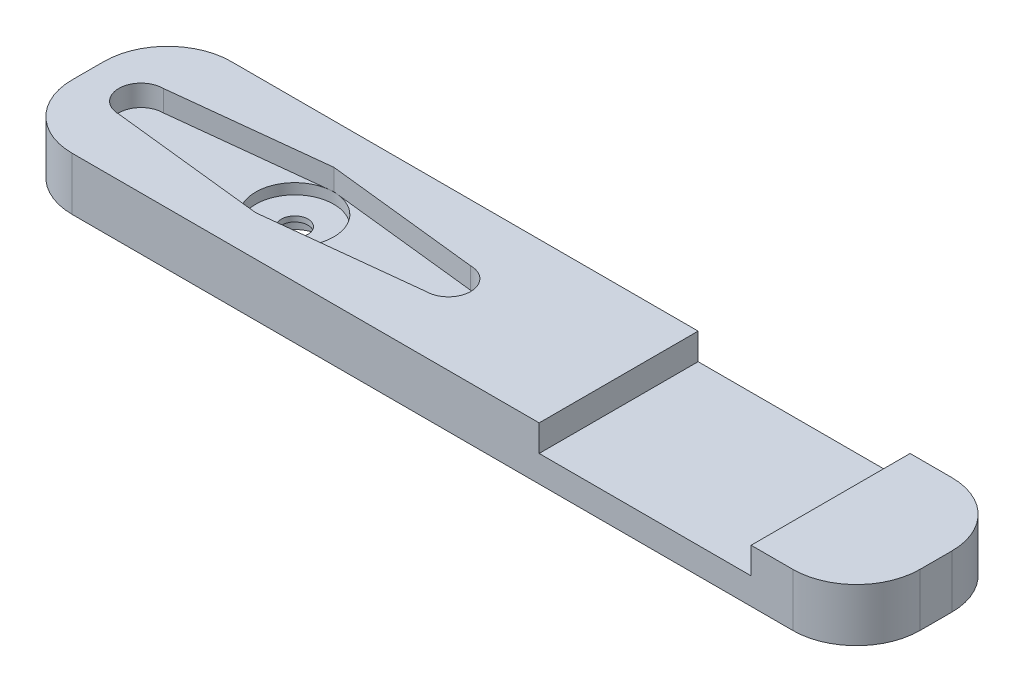
from build123d import *

# Parameters (mm, degrees)
SKETCH1_W           = 80
SKETCH1_H           = 15
BOSS_EXTRUDE1_DEPTH = 5
FILLET1_R           = 6
SKETCH3_W           = 20
SKETCH3_H           = 15
CUT_EXTRUDE2_DEPTH  = 2.5
CUT_EXTRUDE3_DEPTH  = 2
SKETCH5_R           = 1.25
CUT_EXTRUDE4_DEPTH  = 41.807474805
SKETCH6_R           = 2.5
CUT_EXTRUDE5_DEPTH  = 1.5
SKETCH7_R           = 3.677678073
CUT_EXTRUDE6_DEPTH  = 1


with BuildPart() as part:
    # Sketch1 → Boss-Extrude1 (new body)
    with BuildSketch(Plane(origin=(0, 0, 0), x_dir=(1, 0, 0), z_dir=(0, 1, 0))):
        Rectangle(SKETCH1_W, SKETCH1_H)
    extrude(amount=BOSS_EXTRUDE1_DEPTH)

    # Fillet1
    fillet1_edges = [part.edges().sort_by_distance(p)[0] for p in [
        (-40, 2.5, -7.5),
        (40, 2.5, -7.5),
        (40, 2.5, 7.5),
        (-40, 2.5, 7.5),
    ]]
    fillet(fillet1_edges, radius=FILLET1_R)

    # Sketch3 → Cut-Extrude2 (cut)
    with BuildSketch(Plane(origin=(0, 5, 0), x_dir=(1, 0, 0), z_dir=(0, 1, 0))):
        with Locations((20.062463618, 0)):
            Rectangle(SKETCH3_W, SKETCH3_H)
    extrude(amount=-CUT_EXTRUDE2_DEPTH, mode=Mode.SUBTRACT)

    # Sketch4 → Cut-Extrude3 (cut)
    with BuildSketch(Plane(origin=(0, 5, 0), x_dir=(1, 0, 0), z_dir=(0, 1, 0))):
        with BuildLine():
            Line((-20.5, 3.7), (-6, 2.1))
            ThreePointArc((-6, 2.1), (-3.9, 0), (-6, -2.1))
            Line((-6, -2.1), (-20.5, -3.7))
            Line((-20.5, -3.7), (-35, -2.1))
            ThreePointArc((-35, -2.1), (-37.1, 0), (-35, 2.1))
            Line((-35, 2.1), (-20.5, 3.7))
        make_face()
    extrude(amount=-CUT_EXTRUDE3_DEPTH, mode=Mode.SUBTRACT)

    # Sketch5 → Cut-Extrude4 (cut, through all)
    with BuildSketch(Plane(origin=(0, 3, 0), x_dir=(1, 0, 0), z_dir=(0, 1, 0))):
        with Locations(Location((-20.5, 0, 0), (0, 0, 270))):
            Circle(SKETCH5_R)
    extrude(amount=-CUT_EXTRUDE4_DEPTH, mode=Mode.SUBTRACT)

    # Sketch6 → Cut-Extrude5 (cut)
    with BuildSketch(Plane(origin=(0, 0, 0), x_dir=(-1, 0, 0), z_dir=(0, -1, 0))):
        with Locations(Location((20.5, 0, 0), (0, 0, 90))):
            Circle(SKETCH6_R)
    extrude(amount=-CUT_EXTRUDE5_DEPTH, mode=Mode.SUBTRACT)

    # Sketch7 → Cut-Extrude6 (cut)
    with BuildSketch(Plane(origin=(0, 3, 0), x_dir=(1, 0, 0), z_dir=(0, 1, 0))):
        with Locations(Location((-20.5, 0, 0), (0, 0, 270))):
            Circle(SKETCH7_R)
    extrude(amount=-CUT_EXTRUDE6_DEPTH, mode=Mode.SUBTRACT)


solid = part.part
